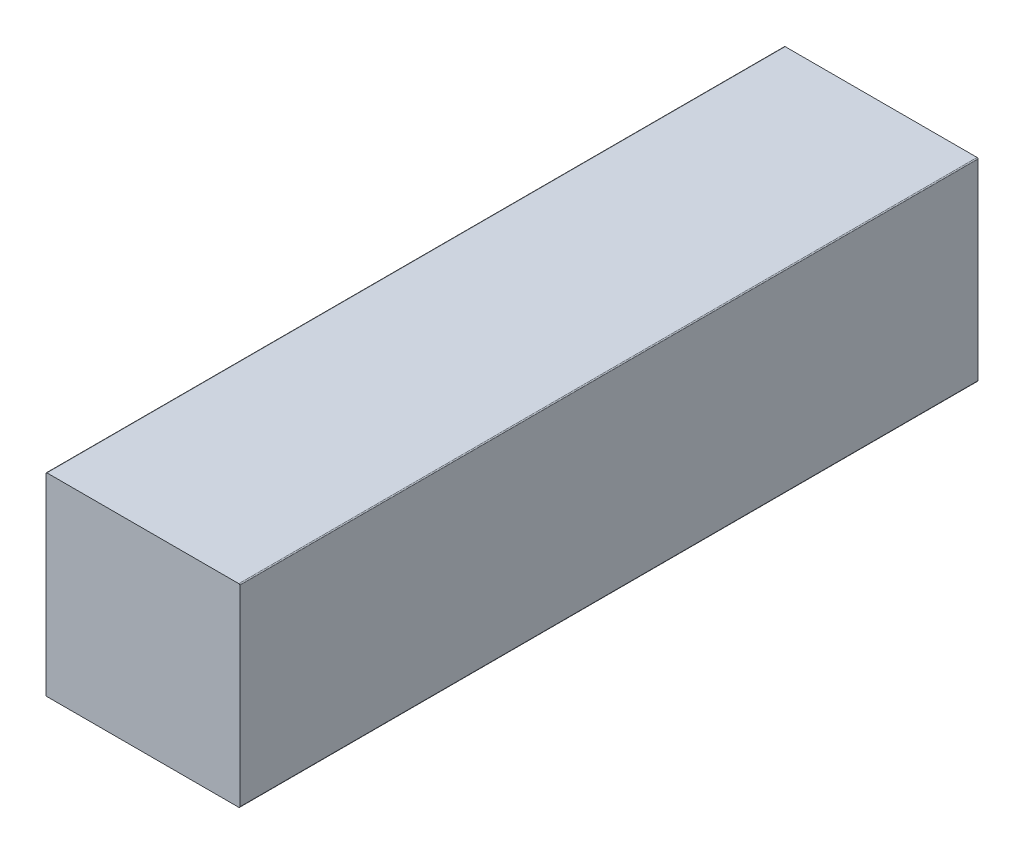
from build123d import *

# Parameters (mm, degrees)
SKETCH3_W           = 5
SKETCH3_H           = 5
BOSS_EXTRUDE1_DEPTH = 152.5
FILLET1_R           = 0.025
SKETCH4_W           = 5
SKETCH4_H           = 5
CUT_EXTRUDE1_DEPTH  = 285.95


with BuildPart() as part:
    # Sketch3 → Boss-Extrude1 (new, symmetric)
    with BuildSketch(Plane.XY):
        Rectangle(SKETCH3_W, SKETCH3_H)
    extrude(amount=BOSS_EXTRUDE1_DEPTH, both=True)

    # Fillet1
    fillet1_edges = [part.edges().sort_by_distance(p)[0] for p in [
        (-2.5, -2.5, 0),
        (-2.5, 2.5, 0),
        (2.5, 2.5, 0),
        (2.5, -2.5, 0),
    ]]
    fillet(fillet1_edges, radius=FILLET1_R)

    # Sketch4 → Cut-Extrude1 (cut)
    with BuildSketch(Plane.XY.offset(152.5)):
        Rectangle(SKETCH4_W, SKETCH4_H)
    extrude(amount=-CUT_EXTRUDE1_DEPTH, mode=Mode.SUBTRACT)


solid = part.part
